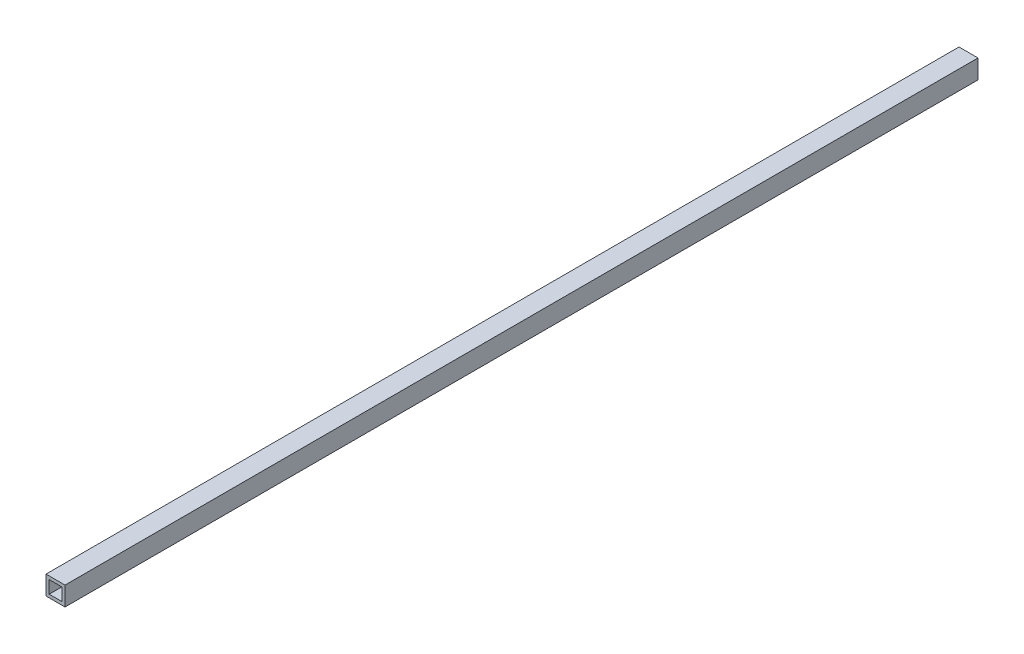
from build123d import *

# Parameters (mm, degrees)
SKETCH1_W           = 19.05
SKETCH1_H           = 19.05
BOSS_EXTRUDE1_DEPTH = 914.4
SKETCH3_W           = 12.7
SKETCH3_H           = 12.7
CUT_EXTRUDE1_DEPTH  = 915.79678891


with BuildPart() as part:
    # Sketch1 → Boss-Extrude1 (new body)
    with BuildSketch(Plane.XY):
        with Locations((9.525, 9.525)):
            Rectangle(SKETCH1_W, SKETCH1_H)
    extrude(amount=BOSS_EXTRUDE1_DEPTH)

    # Sketch3 → Cut-Extrude1 (cut, through all)
    with BuildSketch(Plane.XY.offset(914.4)):
        with Locations((9.525, 9.525)):
            Rectangle(SKETCH3_W, SKETCH3_H)
    extrude(amount=-CUT_EXTRUDE1_DEPTH, mode=Mode.SUBTRACT)


solid = part.part
